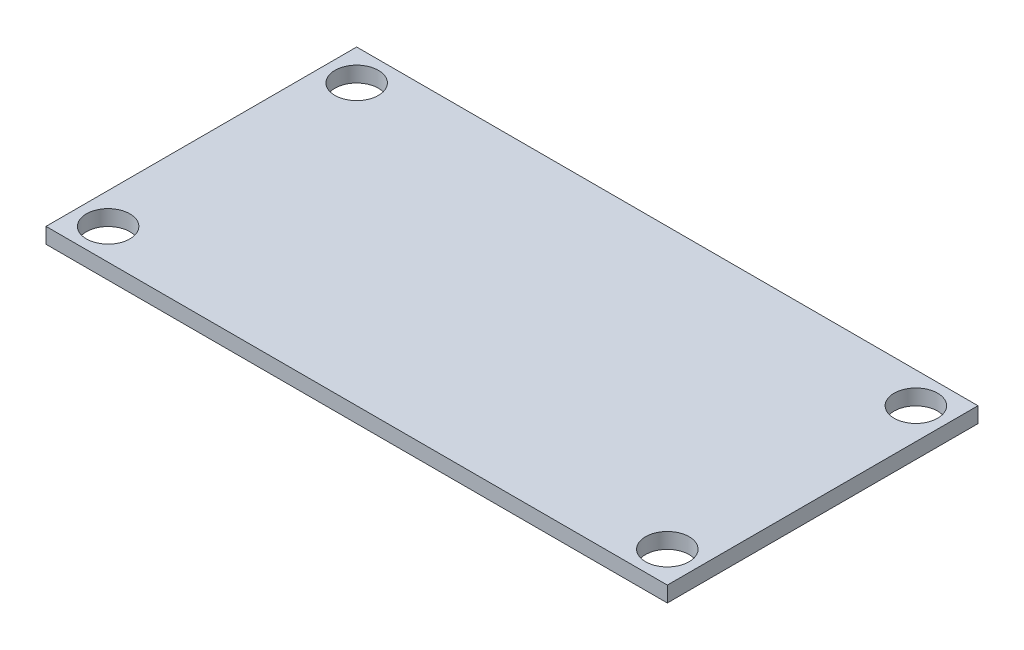
from build123d import *

# Parameters (mm, degrees)
SKETCH1_W           = 40
SKETCH1_H           = 20
BOSS_EXTRUDE1_DEPTH = 1
SKETCH2_R           = 1.4
CUT_EXTRUDE1_DEPTH  = 45.732538493


with BuildPart() as part:
    # Sketch1 → Boss-Extrude1 (new body)
    with BuildSketch(Plane(origin=(0, 0, 0), x_dir=(1, 0, 0), z_dir=(0, 1, 0))):
        with Locations((20, 10)):
            Rectangle(SKETCH1_W, SKETCH1_H)
    extrude(amount=BOSS_EXTRUDE1_DEPTH)

    # Sketch2 → Cut-Extrude1 (cut, through all)
    with BuildSketch(Plane(origin=(0, 1, 0), x_dir=(1, 0, 0), z_dir=(0, 1, 0))):
        with Locations(Location((2, 18, 0), (0, 0, 270))):
            Circle(SKETCH2_R)
        with Locations(Location((38, 18, 0), (0, 0, 270))):
            Circle(SKETCH2_R)
        with Locations(Location((38, 2, 0), (0, 0, 270))):
            Circle(SKETCH2_R)
        with Locations(Location((2, 2, 0), (0, 0, 270))):
            Circle(SKETCH2_R)
    extrude(amount=-CUT_EXTRUDE1_DEPTH, mode=Mode.SUBTRACT)


solid = part.part
